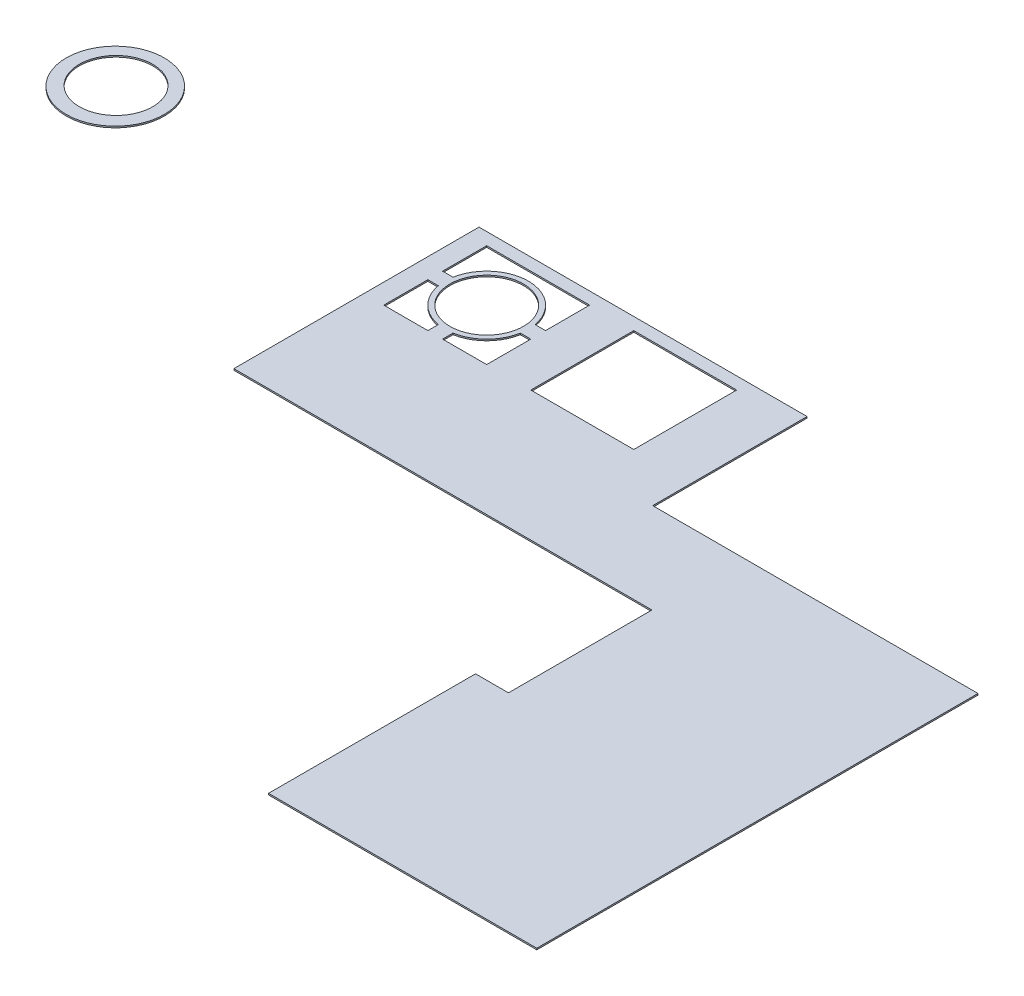
from build123d import *

# Parameters (mm, degrees)
SKETCH1_W               = 2.1
SKETCH1_H               = 2.1
BOSS_EXTRUDE1_DEPTH     = 0.03
BOSS_EXTRUDE2_DEPTH     = 0.03
SKETCH3_R               = 1
BOSS_EXTRUDE3_DEPTH     = 0.03
CUT_EXTRUDE1_DEPTH      = 16.124307753
CUT_EXTRUDE1_DEPTH_BACK = 16.124307753
SKETCH4_R               = 0.75


with BuildPart() as part:
    # Sketch1 → Boss-Extrude1 (new body)
    with BuildSketch(Plane(origin=(0, 0, 0), x_dir=(1, 0, 0), z_dir=(0, 1, 0))):
        Polygon((0, 0), (0, 5), (6.692, 5), (6.692, 1.851), (13.328, 1.851), (13.328, -7.149), (7.856, -7.149), (7.856, -2.927), (8.528, -2.927), (8.528, 0), align=None)
        with Locations((1.457, 3.7)):
            Rectangle(SKETCH1_W, SKETCH1_H, mode=Mode.SUBTRACT)
        with Locations((4.457, 3.7)):
            Rectangle(SKETCH1_W, SKETCH1_H, mode=Mode.SUBTRACT)
    extrude(amount=BOSS_EXTRUDE1_DEPTH)

    # Sketch2 → Boss-Extrude2 (add)
    with BuildSketch(Plane(origin=(0, 0.03, 0), x_dir=(1, 0, 0), z_dir=(0, 1, 0))):
        with BuildLine():
            Line((2.507, 3.55), (2.293660027, 3.55))
            ThreePointArc((2.293660027, 3.55), (2.058040764, 3.098959236), (1.607, 2.863339973))
            Line((1.607, 2.863339973), (1.607, 2.65))
            Line((1.607, 2.65), (1.307, 2.65))
            Line((1.307, 2.65), (1.307, 2.863339973))
            ThreePointArc((1.307, 2.863339973), (0.855959236, 3.098959236), (0.620339973, 3.55))
            Line((0.620339973, 3.55), (0.407, 3.55))
            Line((0.407, 3.55), (0.407, 3.85))
            Line((0.407, 3.85), (0.620339973, 3.85))
            ThreePointArc((0.620339973, 3.85), (1.457, 4.55), (2.293660027, 3.85))
            Line((2.293660027, 3.85), (2.507, 3.85))
            Line((2.507, 3.85), (2.507, 3.55))
        make_face()
    extrude(amount=-BOSS_EXTRUDE2_DEPTH)


with BuildPart() as body_2:
    # Sketch3 → Boss-Extrude3 (new body)
    with BuildSketch(Plane(origin=(0, 0.03, 0), x_dir=(1, 0, 0), z_dir=(0, 1, 0))):
        with Locations(Location((-6.2, 3.78, 0), (0, 0, 270))):
            Circle(SKETCH3_R)
    extrude(amount=-BOSS_EXTRUDE3_DEPTH)


with BuildPart() as cut_extrude1_tool:
    # Sketch4 → Cut-Extrude1 (new, two sides: drawn at the far end of the back side and taken through both)
    with BuildSketch(Plane(origin=(0, 0.03, 0), x_dir=(1, 0, 0), z_dir=(0, 1, 0)).offset(-CUT_EXTRUDE1_DEPTH_BACK)):
        with Locations(Location((-6.204, 3.8, 0), (0, 0, 270))):
            Circle(SKETCH4_R)
        with Locations(Location((1.457, 3.7, 0), (0, 0, 270))):
            Circle(SKETCH4_R)
    extrude(amount=CUT_EXTRUDE1_DEPTH + CUT_EXTRUDE1_DEPTH_BACK)


with BuildPart() as part_1:
    add(part.part)

    # Cut-Extrude1: cut by cut_extrude1_tool
    add(cut_extrude1_tool.part, mode=Mode.SUBTRACT)


with BuildPart() as body_2_1:
    add(body_2.part)

    # Cut-Extrude1: cut by cut_extrude1_tool
    add(cut_extrude1_tool.part, mode=Mode.SUBTRACT)


solid = Compound([part_1.part, body_2_1.part])
